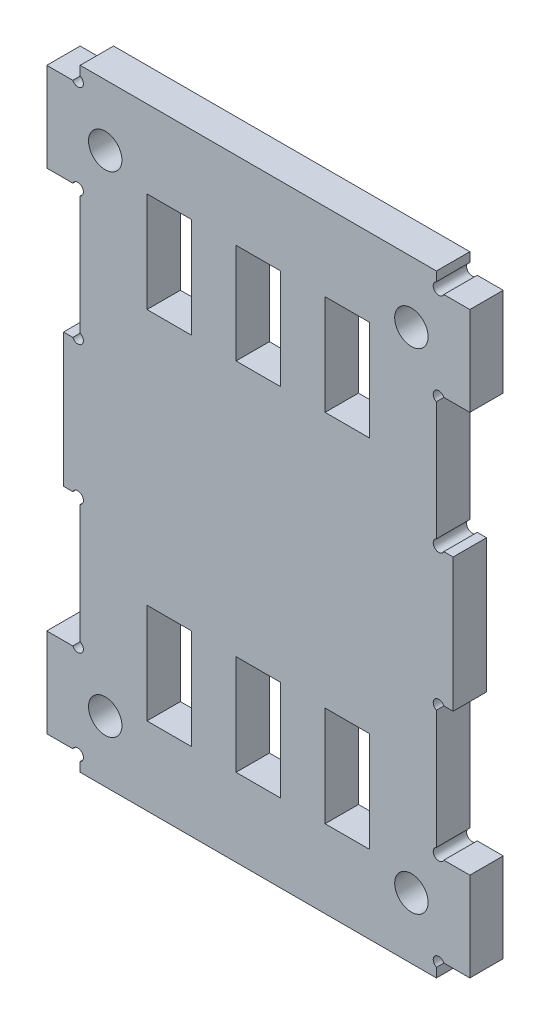
from build123d import *

# Parameters (mm, degrees)
SKETCH_1_W          = 38
SKETCH_1_H          = 55
EXTRUDE_1_DEPTH     = 3
SKETCH_2_W          = 3
SKETCH_2_H          = 36
SKETCH_2_H_2        = 1.5
CUT_EXTRUDE_1_DEPTH = 3
SKETCH_3_R          = 1.5
CUT_EXTRUDE_2_DEPTH = 34.559648389
SKETCH_4_W          = 4
SKETCH_4_H          = 9
CUT_EXTRUDE_3_DEPTH = 10
SKETCH_5_W          = 1.5
SKETCH_5_H          = 12
EXTRUDE_2_DEPTH     = 3
SKETCH_6_R          = 0.5
CUT_EXTRUDE_4_DEPTH = 10


with BuildPart() as part:
    # 草图1 → 凸台-拉伸1 (new body)
    with BuildSketch(Plane.XY):
        Rectangle(SKETCH_1_W, SKETCH_1_H)
    extrude(amount=EXTRUDE_1_DEPTH)

    # 草图2 → 切除-拉伸1 (cut)
    with BuildSketch(Plane.XY.offset(3)):
        with Locations((-17.5, 0)):
            Rectangle(SKETCH_2_W, SKETCH_2_H)
        with Locations((-17.5, 26.75)):
            Rectangle(SKETCH_2_W, SKETCH_2_H_2)
        with Locations((17.5, -26.75)):
            Rectangle(SKETCH_2_W, SKETCH_2_H_2)
        with Locations((17.5, 0)):
            Rectangle(SKETCH_2_W, SKETCH_2_H)
        with Locations((17.5, 26.75)):
            Rectangle(SKETCH_2_W, SKETCH_2_H_2)
        with Locations((-17.5, -26.75)):
            Rectangle(SKETCH_2_W, SKETCH_2_H_2)
    extrude(amount=-CUT_EXTRUDE_1_DEPTH, mode=Mode.SUBTRACT)

    # 草图3 → 切除-拉伸2 (cut, through all)
    with BuildSketch(Plane.XY.offset(3)):
        with Locations((-13.75, -22)):
            Circle(SKETCH_3_R)
        with Locations(Location((13.75, -22, 0), (0, 0, 180))):
            Circle(SKETCH_3_R)
        with Locations((13.75, 22)):
            Circle(SKETCH_3_R)
        with Locations(Location((-13.75, 22, 0), (0, 0, 180))):
            Circle(SKETCH_3_R)
    extrude(amount=-CUT_EXTRUDE_2_DEPTH, mode=Mode.SUBTRACT)

    # 草图4 → 切除-拉伸3 (cut)
    with BuildSketch(Plane.XY.offset(3)):
        with Locations((8, -16)):
            Rectangle(SKETCH_4_W, SKETCH_4_H)
        with Locations((0, -16)):
            Rectangle(SKETCH_4_W, SKETCH_4_H)
        with Locations((-8, -16)):
            Rectangle(SKETCH_4_W, SKETCH_4_H)
        with Locations((-8, 16)):
            Rectangle(SKETCH_4_W, SKETCH_4_H)
        with Locations((8, 16)):
            Rectangle(SKETCH_4_W, SKETCH_4_H)
        with Locations((0, 16)):
            Rectangle(SKETCH_4_W, SKETCH_4_H)
    extrude(amount=-CUT_EXTRUDE_3_DEPTH, mode=Mode.SUBTRACT)

    # 草图5 → 凸台-拉伸2 (add, through all)
    with BuildSketch(Plane.XY.offset(3)):
        with Locations((-16.75, 0)):
            Rectangle(SKETCH_5_W, SKETCH_5_H)
        with Locations((16.75, 0)):
            Rectangle(SKETCH_5_W, SKETCH_5_H)
    extrude(amount=-EXTRUDE_2_DEPTH)

    # 草图6 → 切除-拉伸4 (cut)
    with BuildSketch(Plane.XY.offset(3)):
        with Locations((-16.212132034, -26.212132034)):
            Circle(SKETCH_6_R)
        with Locations((-16.212132034, -17.787867966)):
            Circle(SKETCH_6_R)
        with Locations((-16.212132034, -6.212132034)):
            Circle(SKETCH_6_R)
        with Locations((16.212132034, -6.212132034)):
            Circle(SKETCH_6_R)
        with Locations((16.212132034, -17.787867966)):
            Circle(SKETCH_6_R)
        with Locations((16.212132034, -26.212132034)):
            Circle(SKETCH_6_R)
        with Locations((16.212132034, 26.212132034)):
            Circle(SKETCH_6_R)
        with Locations((16.212132034, 17.787867966)):
            Circle(SKETCH_6_R)
        with Locations((16.212132034, 6.212132034)):
            Circle(SKETCH_6_R)
        with Locations((-16.212132034, 6.212132034)):
            Circle(SKETCH_6_R)
        with Locations((-16.212132034, 17.787867966)):
            Circle(SKETCH_6_R)
        with Locations((-16.212132034, 26.212132034)):
            Circle(SKETCH_6_R)
    extrude(amount=-CUT_EXTRUDE_4_DEPTH, mode=Mode.SUBTRACT)


solid = part.part
